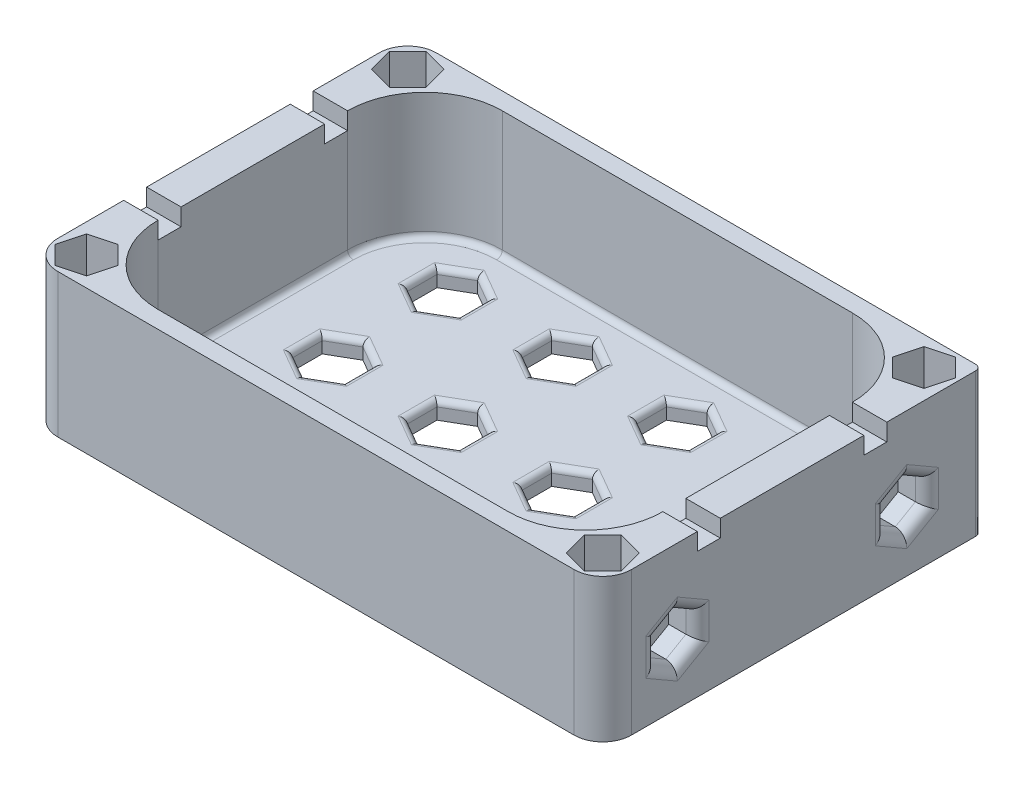
from build123d import *

# Parameters (mm, degrees)
BOSS_EXTRUDE7_DEPTH = 25
BOSS_EXTRUDE9_DEPTH = 3
CUT_EXTRUDE1_DEPTH  = 5
CUT_EXTRUDE2_DEPTH  = 5
FILLET3_R           = 2
FILLET2_R           = 1
FILLET4_R           = 1
SKETCH7_W           = 6
SKETCH7_H           = 4
CUT_EXTRUDE3_DEPTH  = 3


with BuildPart() as part:
    # Sketch3 → Boss-Extrude7 (new body)
    with BuildSketch(Plane.XZ):
        with BuildLine():
            Line((-5, -33), (0, -33))
            Line((0, -33), (-1.464466094, -31.535533906))
            ThreePointArc((-1.464466094, -31.535533906), (-3.086582838, -32.619397663), (-5, -33))
        make_face()
        with BuildLine():
            Line((0, -33), (0, -28))
            ThreePointArc((0, -28), (-0.380602337, -29.913417162), (-1.464466094, -31.535533906))
            Line((-1.464466094, -31.535533906), (0, -33))
        make_face()
        with BuildLine():
            ThreePointArc((0, -28), (-1.464466094, -24.464466094), (-5, -23))
            ThreePointArc((-5, -23), (-6.913417162, -23.380602337), (-8.535533906, -24.464466094))
            Line((-8.535533906, -24.464466094), (-7.740038777, -25.259961223))
            Line((-7.740038779, -25.259961224), (-6.158076652, -23.677999097))
            Line((-6.158076652, -23.677999097), (-3.997076244, -24.257037411))
            Line((-3.997076244, -24.257037411), (-1.836075749, -24.836075749))
            Line((-1.836075749, -24.836075749), (-1.257037428, -26.99707618))
            Line((-1.257037428, -26.99707618), (-0.677999097, -29.158076652))
            Line((-0.677999097, -29.158076652), (-2.259961219, -30.740038773))
            Line((-2.259961223, -30.740038777), (-1.464466094, -31.535533906))
            ThreePointArc((-1.464466094, -31.535533906), (-0.380602337, -29.913417162), (0, -28))
        make_face()
        with BuildLine():
            Line((-7.740038777, -25.259961223), (-8.535533906, -24.464466094))
            ThreePointArc((-8.535533906, -24.464466094), (-8.732910174, -24.67353316), (-8.917942987, -24.893599712))
            ThreePointArc((-8.917942987, -24.893599712), (-9.721743054, -26.355268249), (-10, -28))
            ThreePointArc((-10, -28), (-8.535533906, -31.535533906), (-5, -33))
            ThreePointArc((-5, -33), (-3.086582838, -32.619397663), (-1.464466094, -31.535533906))
            Line((-1.464466094, -31.535533906), (-2.259961223, -30.740038777))
            Line((-2.259961219, -30.740038773), (-3.841923348, -32.322000903))
            Line((-3.841923348, -32.322000903), (-6.002923801, -31.742962577))
            Line((-6.002923801, -31.742962577), (-8.163924251, -31.163924251))
            Line((-8.163924251, -31.163924251), (-8.742962601, -29.002923708))
            Line((-8.742962601, -29.002923708), (-9.322000903, -26.841923348))
            Line((-9.322000903, -26.841923348), (-7.740038779, -25.259961224))
        make_face()
        with BuildLine():
            Line((0, -28), (0, -23))
            Line((0, -23), (-5, -23))
            ThreePointArc((-5, -23), (-1.464466094, -24.464466094), (0, -28))
        make_face()
        with BuildLine():
            Line((-5, -23), (-6, -23))
            Line((-6, -23), (-7.661030441, -23))
            ThreePointArc((-7.661030441, -23), (-8.091942003, -23.730311477), (-8.567907791, -24.432092209))
            Line((-8.567907791, -24.432092209), (-8.535533906, -24.464466094))
            ThreePointArc((-8.535533906, -24.464466094), (-6.913417162, -23.380602337), (-5, -23))
        make_face()
        with BuildLine():
            ThreePointArc((-8.917942987, -24.893599712), (-9.440797856, -25.51377538), (-10, -26.101387527))
            Line((-10, -26.101387527), (-10, -28))
            ThreePointArc((-10, -28), (-9.721743054, -26.355268249), (-8.917942987, -24.893599712))
        make_face()
        with BuildLine():
            Line((-8.535533906, -24.464466094), (-8.567907791, -24.432092209))
            ThreePointArc((-8.567907791, -24.432092209), (-8.740446841, -24.664725841), (-8.917942987, -24.893599712))
            ThreePointArc((-8.917942987, -24.893599712), (-8.732910174, -24.67353316), (-8.535533906, -24.464466094))
        make_face()
        with BuildLine():
            ThreePointArc((-5, -33), (-8.535533906, -31.535533906), (-10, -28))
            Line((-10, -28), (-10, -30))
            Line((-10, -30), (-10, -33))
            Line((-10, -33), (-5, -33))
        make_face()
        with BuildLine():
            Line((-10, -28), (-10, -26.101387527))
            ThreePointArc((-10, -26.101387527), (-14.356609245, -28.987317436), (-19.483314774, -30))
            Line((-19.483314774, -30), (-10, -30))
            Line((-10, -30), (-10, -28))
        make_face()
        Polygon((-10, -30), (-19.483314774, -30), (-80.516685226, -30), (-90, -30), (-90, -33), (-10, -33), align=None)
        Polygon((0, 0), (-6, 0), (-6, -16.516685226), (-6, -23), (-5, -23), (0, -23), align=None)
        with BuildLine():
            Line((-6, -23), (-6, -16.516685226))
            ThreePointArc((-6, -16.516685226), (-6.421857001, -19.863041177), (-7.661030441, -23))
            Line((-7.661030441, -23), (-6, -23))
        make_face()
        Polygon((-6, 16.516685226), (-6, 0), (0, 0), (0, 23), (-5, 23), (-6, 23), align=None)
        with BuildLine():
            ThreePointArc((-7.661030441, 23), (-6.421857001, 19.863041177), (-6, 16.516685226))
            Line((-6, 16.516685226), (-6, 23))
            Line((-6, 23), (-7.661030441, 23))
        make_face()
        with BuildLine():
            Line((-7.661030441, 23), (-6, 23))
            Line((-6, 23), (-5, 23))
            ThreePointArc((-5, 23), (-6.913417162, 23.380602337), (-8.535533906, 24.464466094))
            Line((-8.535533906, 24.464466094), (-8.567907791, 24.432092209))
            ThreePointArc((-8.567907791, 24.432092209), (-8.091942003, 23.730311477), (-7.661030441, 23))
        make_face()
        with BuildLine():
            Line((-10, 28), (-10, 26.101387527))
            ThreePointArc((-10, 26.101387527), (-9.440797857, 25.513775382), (-8.91794299, 24.893599716))
            ThreePointArc((-8.91794299, 24.893599716), (-9.721743055, 26.355268251), (-10, 28))
        make_face()
        with BuildLine():
            ThreePointArc((-19.483314774, 30), (-14.356609245, 28.987317436), (-10, 26.101387527))
            Line((-10, 26.101387527), (-10, 28))
            Line((-10, 28), (-10, 30))
            Line((-10, 30), (-19.483314774, 30))
        make_face()
        with BuildLine():
            ThreePointArc((-8.91794299, 24.893599716), (-8.740446842, 24.664725843), (-8.567907791, 24.432092209))
            Line((-8.567907791, 24.432092209), (-8.535533906, 24.464466094))
            ThreePointArc((-8.535533906, 24.464466094), (-8.732910175, 24.673533162), (-8.91794299, 24.893599716))
        make_face()
        with BuildLine():
            ThreePointArc((-8.91794299, 24.893599716), (-8.732910175, 24.673533162), (-8.535533906, 24.464466094))
            Line((-8.535533906, 24.464466094), (-7.740038777, 25.259961223))
            Line((-7.740038777, 25.259961223), (-9.322000903, 26.841923348))
            Line((-9.322000903, 26.841923348), (-8.742962597, 29.002923724))
            Line((-8.742962597, 29.002923724), (-8.163924251, 31.163924251))
            Line((-8.163924251, 31.163924251), (-6.002923796, 31.742962578))
            Line((-6.002923796, 31.742962578), (-3.841923348, 32.322000903))
            Line((-3.841923348, 32.322000903), (-2.259961222, 30.740038776))
            Line((-2.259961223, 30.740038777), (-1.464466094, 31.535533906))
            ThreePointArc((-1.464466094, 31.535533906), (-3.086582838, 32.619397663), (-5, 33))
            ThreePointArc((-5, 33), (-8.535533906, 31.535533906), (-10, 28))
            ThreePointArc((-10, 28), (-9.721743055, 26.355268251), (-8.91794299, 24.893599716))
        make_face()
        with BuildLine():
            ThreePointArc((-8.535533906, 24.464466094), (-6.913417162, 23.380602337), (-5, 23))
            ThreePointArc((-5, 23), (-1.464466094, 24.464466094), (0, 28))
            ThreePointArc((0, 28), (-0.380602337, 29.913417162), (-1.464466094, 31.535533906))
            Line((-1.464466094, 31.535533906), (-2.259961223, 30.740038777))
            Line((-2.259961222, 30.740038776), (-0.677999097, 29.158076652))
            Line((-0.677999097, 29.158076652), (-1.257037425, 26.997076192))
            Line((-1.257037425, 26.997076192), (-1.836075749, 24.836075749))
            Line((-1.836075749, 24.836075749), (-3.997076664, 24.257037299))
            Line((-3.997076664, 24.257037299), (-6.158076652, 23.677999097))
            Line((-6.158076652, 23.677999097), (-7.740038777, 25.259961223))
            Line((-7.740038777, 25.259961223), (-8.535533906, 24.464466094))
        make_face()
        with BuildLine():
            Line((-5, 23), (0, 23))
            Line((0, 23), (0, 28))
            ThreePointArc((0, 28), (-1.464466094, 24.464466094), (-5, 23))
        make_face()
        Polygon((-80.516685226, 30), (-19.483314774, 30), (-10, 30), (-10, 33), (-90, 33), (-90, 30), align=None)
        with BuildLine():
            Line((-10, 30), (-10, 28))
            ThreePointArc((-10, 28), (-8.535533906, 31.535533906), (-5, 33))
            Line((-5, 33), (-10, 33))
            Line((-10, 33), (-10, 30))
        make_face()
        with BuildLine():
            Line((-90, -30), (-80.516685226, -30))
            ThreePointArc((-80.516685226, -30), (-85.643390755, -28.987317436), (-90, -26.101387527))
            Line((-90, -26.101387527), (-90, -28))
            Line((-90, -28), (-90, -30))
        make_face()
        with BuildLine():
            Line((-90, -33), (-90, -30))
            Line((-90, -30), (-90, -28))
            ThreePointArc((-90, -28), (-91.464466094, -31.535533906), (-95, -33))
            Line((-95, -33), (-90, -33))
        make_face()
        with BuildLine():
            ThreePointArc((-95, -33), (-91.464466094, -31.535533906), (-90, -28))
            ThreePointArc((-90, -28), (-90.278256873, -26.355268458), (-91.082056738, -24.893600059))
            ThreePointArc((-91.082056738, -24.893600059), (-91.267089679, -24.673533326), (-91.464466094, -24.464466094))
            Line((-91.464466094, -24.464466094), (-92.259961223, -25.259961223))
            Line((-92.259961223, -25.259961223), (-90.677999097, -26.841923348))
            Line((-90.677999097, -26.841923348), (-91.257037439, -29.00292386))
            Line((-91.257037439, -29.00292386), (-91.836075749, -31.163924251))
            Line((-91.836075749, -31.163924251), (-93.997076192, -31.742962575))
            Line((-93.997076192, -31.742962575), (-96.158076652, -32.322000903))
            Line((-96.158076652, -32.322000903), (-97.740038777, -30.740038777))
            Line((-97.740038777, -30.740038777), (-98.535533906, -31.535533906))
            ThreePointArc((-98.535533906, -31.535533906), (-96.913417162, -32.619397663), (-95, -33))
        make_face()
        with BuildLine():
            Line((-92.259961223, -25.259961223), (-91.464466094, -24.464466094))
            ThreePointArc((-91.464466094, -24.464466094), (-93.086582815, -23.380602347), (-94.999999951, -23))
            ThreePointArc((-94.999999951, -23), (-98.535533888, -24.464466077), (-100, -28))
            ThreePointArc((-100, -28), (-99.619397663, -29.913417162), (-98.535533906, -31.535533906))
            Line((-98.535533906, -31.535533906), (-97.740038777, -30.740038777))
            Line((-97.740038777, -30.740038777), (-99.322000903, -29.158076652))
            Line((-99.322000903, -29.158076652), (-98.742962693, -26.997076632))
            Line((-98.742962693, -26.997076632), (-98.163924251, -24.836075749))
            Line((-98.163924251, -24.836075749), (-96.002923368, -24.257037307))
            Line((-96.002923368, -24.257037307), (-93.841923348, -23.677999097))
            Line((-93.841923348, -23.677999097), (-92.259961223, -25.259961223))
        make_face()
        with BuildLine():
            ThreePointArc((-100, -28), (-98.535533888, -24.464466077), (-94.999999951, -23))
            Line((-94.999999951, -23), (-100, -23))
            Line((-100, -23), (-100, -28))
        make_face()
        with BuildLine():
            ThreePointArc((-91.464466094, -24.464466094), (-91.267089679, -24.673533326), (-91.082056738, -24.893600059))
            ThreePointArc((-91.082056738, -24.893600059), (-91.259553025, -24.664726018), (-91.432092209, -24.432092209))
            Line((-91.432092209, -24.432092209), (-91.464466094, -24.464466094))
        make_face()
        with BuildLine():
            ThreePointArc((-91.432092209, -24.432092209), (-91.908057997, -23.730311477), (-92.338969559, -23))
            Line((-92.338969559, -23), (-94, -23))
            Line((-94, -23), (-94.999999951, -23))
            ThreePointArc((-94.999999951, -23), (-93.086582815, -23.380602347), (-91.464466094, -24.464466094))
            Line((-91.464466094, -24.464466094), (-91.432092209, -24.432092209))
        make_face()
        with BuildLine():
            Line((-90, -28), (-90, -26.101387527))
            ThreePointArc((-90, -26.101387527), (-90.559201997, -25.513775545), (-91.082056738, -24.893600059))
            ThreePointArc((-91.082056738, -24.893600059), (-90.278256873, -26.355268458), (-90, -28))
        make_face()
        Polygon((-94, 16.516685226), (-94, 23), (-95, 23), (-100, 23), (-100, -23), (-94.999999951, -23), (-94, -23), (-94, -16.516685226), align=None)
        with BuildLine():
            Line((-94, -23), (-92.338969559, -23))
            ThreePointArc((-92.338969559, -23), (-93.578142999, -19.863041177), (-94, -16.516685226))
            Line((-94, -16.516685226), (-94, -23))
        make_face()
        with BuildLine():
            ThreePointArc((-94, 16.516685226), (-93.578142999, 19.863041177), (-92.338969559, 23))
            Line((-92.338969559, 23), (-94, 23))
            Line((-94, 23), (-94, 16.516685226))
        make_face()
        with BuildLine():
            Line((-94, 23), (-92.338969559, 23))
            ThreePointArc((-92.338969559, 23), (-91.908057997, 23.730311477), (-91.432092209, 24.432092209))
            Line((-91.432092209, 24.432092209), (-91.464466094, 24.464466094))
            ThreePointArc((-91.464466094, 24.464466094), (-93.086582838, 23.380602337), (-95, 23))
            Line((-95, 23), (-94, 23))
        make_face()
        with BuildLine():
            ThreePointArc((-91.432092209, 24.432092209), (-91.259553334, 24.66472561), (-91.082057373, 24.893599258))
            ThreePointArc((-91.082057373, 24.893599258), (-91.267090019, 24.673532944), (-91.464466094, 24.464466094))
            Line((-91.464466094, 24.464466094), (-91.432092209, 24.432092209))
        make_face()
        with BuildLine():
            ThreePointArc((-91.082057373, 24.893599258), (-90.559202338, 25.513775164), (-90, 26.101387527))
            Line((-90, 26.101387527), (-90, 28))
            ThreePointArc((-90, 28), (-90.278257041, 26.355267975), (-91.082057373, 24.893599258))
        make_face()
        with BuildLine():
            ThreePointArc((-91.082057373, 24.893599258), (-90.278257041, 26.355267975), (-90, 28))
            ThreePointArc((-90, 28), (-91.464466094, 31.535533906), (-95, 33))
            ThreePointArc((-95, 33), (-96.913417162, 32.619397663), (-98.535533906, 31.535533906))
            Line((-98.535533906, 31.535533906), (-97.740038777, 30.740038777))
            Line((-97.740038777, 30.740038777), (-96.158076652, 32.322000903))
            Line((-96.158076652, 32.322000903), (-93.997076276, 31.742962597))
            Line((-93.997076276, 31.742962597), (-91.836075749, 31.163924251))
            Line((-91.836075749, 31.163924251), (-91.257037406, 29.002923736))
            Line((-91.257037406, 29.002923736), (-90.677999097, 26.841923348))
            Line((-90.677999097, 26.841923348), (-92.259961223, 25.259961223))
            Line((-92.259961223, 25.259961223), (-91.464466094, 24.464466094))
            ThreePointArc((-91.464466094, 24.464466094), (-91.267090019, 24.673532944), (-91.082057373, 24.893599258))
        make_face()
        with BuildLine():
            ThreePointArc((-95, 23), (-93.086582838, 23.380602337), (-91.464466094, 24.464466094))
            Line((-91.464466094, 24.464466094), (-92.259961223, 25.259961223))
            Line((-92.259961223, 25.259961223), (-93.841923348, 23.677999097))
            Line((-93.841923348, 23.677999097), (-96.00292408, 24.257037498))
            Line((-96.00292408, 24.257037498), (-98.163924251, 24.836075749))
            Line((-98.163924251, 24.836075749), (-98.742962597, 26.997076276))
            Line((-98.742962597, 26.997076276), (-99.322000903, 29.158076652))
            Line((-99.322000903, 29.158076652), (-97.740038777, 30.740038777))
            Line((-97.740038777, 30.740038777), (-98.535533906, 31.535533906))
            ThreePointArc((-98.535533906, 31.535533906), (-99.619397687, 29.913417102), (-100, 27.999999871))
            ThreePointArc((-100, 27.999999871), (-98.53553386, 24.464466048), (-95, 23))
        make_face()
        with BuildLine():
            Line((-100, 23), (-95, 23))
            ThreePointArc((-95, 23), (-98.53553386, 24.464466048), (-100, 27.999999871))
            Line((-100, 27.999999871), (-100, 23))
        make_face()
        with BuildLine():
            Line((-90, 28), (-90, 30))
            Line((-90, 30), (-90, 33))
            Line((-90, 33), (-95, 33))
            ThreePointArc((-95, 33), (-91.464466094, 31.535533906), (-90, 28))
        make_face()
        with BuildLine():
            ThreePointArc((-90, 26.101387527), (-85.643390755, 28.987317436), (-80.516685226, 30))
            Line((-80.516685226, 30), (-90, 30))
            Line((-90, 30), (-90, 28))
            Line((-90, 28), (-90, 26.101387527))
        make_face()
    extrude(amount=-BOSS_EXTRUDE7_DEPTH)

    # Sketch3<7> → Boss-Extrude9 (add)
    with BuildSketch(Plane.XZ):
        with BuildLine():
            Line((-6, -16.516685226), (-6, 0))
            Line((-6, 0), (-6, 16.516685226))
            ThreePointArc((-6, 16.516685226), (-9.949171464, 26.050828536), (-19.483314774, 30))
            Line((-19.483314774, 30), (-80.516685226, 30))
            ThreePointArc((-80.516685226, 30), (-90.050828536, 26.050828536), (-94, 16.516685226))
            Line((-94, 16.516685226), (-94, -16.516685226))
            ThreePointArc((-94, -16.516685226), (-90.050828536, -26.050828536), (-80.516685226, -30))
            Line((-80.516685226, -30), (-19.483314774, -30))
            ThreePointArc((-19.483314774, -30), (-9.949171464, -26.050828536), (-6, -16.516685226))
        make_face()
        Polygon((-84.5, -17.401923789), (-80, -14.803847577), (-75.5, -17.401923789), (-75.5, -22.598076211), (-80, -25.196152423), (-84.5, -22.598076211), align=None, mode=Mode.SUBTRACT)
        Polygon((-64.5, -17.401923789), (-60, -14.803847577), (-55.5, -17.401923789), (-55.5, -22.598076211), (-60, -25.196152423), (-64.5, -22.598076211), align=None, mode=Mode.SUBTRACT)
        Polygon((-75.5, 2.598076211), (-75.5, -2.598076211), (-80, -5.196152423), (-84.5, -2.598076211), (-84.5, 2.598076211), (-80, 5.196152423), align=None, mode=Mode.SUBTRACT)
        Polygon((-44.5, -17.401923789), (-40, -14.803847577), (-35.5, -17.401923789), (-35.5, -22.598076211), (-40, -25.196152423), (-44.5, -22.598076211), align=None, mode=Mode.SUBTRACT)
        Polygon((-24.5, -22.598076211), (-24.5, -17.401923789), (-20, -14.803847577), (-15.5, -17.401923789), (-15.5, -22.598076211), (-20, -25.196152423), align=None, mode=Mode.SUBTRACT)
        Polygon((-55.5, 2.598076211), (-55.5, -2.598076211), (-60, -5.196152423), (-64.5, -2.598076211), (-64.5, 2.598076211), (-60, 5.196152423), align=None, mode=Mode.SUBTRACT)
        Polygon((-75.5, 17.401923789), (-80, 14.803847577), (-84.5, 17.401923789), (-84.5, 22.598076211), (-80, 25.196152423), (-75.5, 22.598076211), align=None, mode=Mode.SUBTRACT)
        Polygon((-60, 14.803847577), (-64.5, 17.401923789), (-64.5, 22.598076211), (-60, 25.196152423), (-55.5, 22.598076211), (-55.5, 17.401923789), align=None, mode=Mode.SUBTRACT)
        Polygon((-35.5, 2.598076211), (-35.5, -2.598076211), (-40, -5.196152423), (-44.5, -2.598076211), (-44.5, 2.598076211), (-40, 5.196152423), align=None, mode=Mode.SUBTRACT)
        Polygon((-15.5, 2.598076211), (-15.5, 0), (-15.5, -2.598076211), (-20, -5.196152423), (-24.5, -2.598076211), (-24.5, 2.598076211), (-20, 5.196152423), align=None, mode=Mode.SUBTRACT)
        Polygon((-35.5, 22.598076211), (-35.5, 17.401923789), (-40, 14.803847577), (-44.5, 17.401923789), (-44.5, 22.598076211), (-40, 25.196152423), align=None, mode=Mode.SUBTRACT)
        Polygon((-15.5, 17.401923789), (-20, 14.803847577), (-24.5, 17.401923789), (-24.5, 22.598076211), (-20, 25.196152423), (-15.5, 22.598076211), align=None, mode=Mode.SUBTRACT)
    extrude(amount=-BOSS_EXTRUDE9_DEPTH)

    # Sketch5 → Cut-Extrude1 (cut)
    with BuildSketch(Plane.ZY.offset(100)):
        Polygon((-20, 6.458548116), (-16.5, 8.479274058), (-16.5, 12.520725942), (-20, 14.541451884), (-23.5, 12.520725942), (-23.5, 8.479274058), align=None)
        Polygon((23.5, 8.479274058), (23.5, 12.520725942), (20, 14.541451884), (16.5, 12.520725942), (16.5, 8.479274058), (20, 6.458548116), align=None)
    extrude(amount=-CUT_EXTRUDE1_DEPTH, mode=Mode.SUBTRACT)

    # Sketch6 → Cut-Extrude2 (cut)
    with BuildSketch(Plane(origin=(0, 0, 0), x_dir=(0, 0, -1), z_dir=(1, 0, 0))):
        Polygon((-20, 6.458548116), (-16.5, 8.479274058), (-16.5, 12.520725942), (-20, 14.541451884), (-23.5, 12.520725942), (-23.5, 8.479274058), align=None)
        Polygon((20, 6.458548116), (23.5, 8.479274058), (23.5, 12.520725942), (20, 14.541451884), (16.5, 12.520725942), (16.5, 8.479274058), align=None)
    extrude(amount=-CUT_EXTRUDE2_DEPTH, mode=Mode.SUBTRACT)

    # Fillet3
    fillet3_edges = [part.edges().sort_by_distance(p)[0] for p in [
        (-100, 7.468911087, -21.75),
        (-100, 7.468911087, -18.25),
        (-100, 10.5, -16.5),
        (-100, 13.531088913, -18.25),
        (-100, 13.531088913, -21.75),
        (-100, 10.5, -23.5),
        (-100, 7.468911087, 18.25),
        (-100, 7.468911087, 21.75),
        (-100, 10.5, 23.5),
        (-100, 13.531088913, 21.75),
        (-100, 13.531088913, 18.25),
        (-100, 10.5, 16.5),
        (0, 13.531088913, 18.25),
        (0, 13.531088913, 21.75),
        (0, 10.5, 23.5),
        (0, 7.468911087, 21.75),
        (0, 7.468911087, 18.25),
        (0, 10.5, 16.5),
        (0, 13.531088913, -21.75),
        (0, 13.531088913, -18.25),
        (0, 10.5, -16.5),
        (0, 7.468911087, -18.25),
        (0, 7.468911087, -21.75),
        (0, 10.5, -23.5),
    ]]
    fillet(fillet3_edges, radius=FILLET3_R)

    # Fillet2
    fillet2_edges = [part.edges().sort_by_distance(p)[0] for p in [
        (0, 12.5, -33),
    ]]
    fillet(fillet2_edges, radius=FILLET2_R)

    # Fillet4
    fillet4_edges = [part.edges().sort_by_distance(p)[0] for p in [
        (-50, 3, -30),
        (-90.050828536, 3, -26.050828536),
        (-94, 3, 0),
        (-37.75, 3, 3.897114317),
        (-42.25, 3, 3.897114317),
        (-44.5, 3, 0),
        (-42.25, 3, -3.897114317),
        (-37.75, 3, -3.897114317),
        (-35.5, 3, 0),
        (-62.25, 3, 16.102885683),
        (-57.75, 3, 16.102885683),
        (-55.5, 3, 20),
        (-57.75, 3, 23.897114317),
        (-62.25, 3, 23.897114317),
        (-64.5, 3, 20),
        (-75.5, 3, 0),
        (-77.75, 3, 3.897114317),
        (-82.25, 3, 3.897114317),
        (-84.5, 3, 0),
        (-82.25, 3, -3.897114317),
        (-77.75, 3, -3.897114317),
        (-62.25, 3, -3.897114317),
        (-57.75, 3, -3.897114317),
        (-55.5, 3, 0),
        (-57.75, 3, 3.897114317),
        (-62.25, 3, 3.897114317),
        (-64.5, 3, 0),
        (-42.25, 3, 16.102885683),
        (-37.75, 3, 16.102885683),
        (-35.5, 3, 20),
        (-37.75, 3, 23.897114317),
        (-42.25, 3, 23.897114317),
        (-44.5, 3, 20),
        (-37.75, 3, -16.102885683),
        (-42.25, 3, -16.102885683),
        (-44.5, 3, -20),
        (-42.25, 3, -23.897114317),
        (-37.75, 3, -23.897114317),
        (-35.5, 3, -20),
        (-22.25, 3, 3.897114317),
        (-24.5, 3, 0),
        (-22.25, 3, -3.897114317),
        (-17.75, 3, -3.897114317),
        (-15.5, 3, 0),
        (-17.75, 3, 3.897114317),
        (-90.050828536, 3, 26.050828536),
        (-50, 3, 30),
        (-9.949171464, 3, 26.050828536),
        (-6, 3, 0),
        (-9.949171464, 3, -26.050828536),
        (-22.25, 3, 16.102885683),
        (-17.75, 3, 16.102885683),
        (-15.5, 3, 20),
        (-17.75, 3, 23.897114317),
        (-22.25, 3, 23.897114317),
        (-24.5, 3, 20),
        (-77.75, 3, 16.102885683),
        (-75.5, 3, 20),
        (-77.75, 3, 23.897114317),
        (-82.25, 3, 23.897114317),
        (-84.5, 3, 20),
        (-82.25, 3, 16.102885683),
        (-77.75, 3, -16.102885683),
        (-82.25, 3, -16.102885683),
        (-84.5, 3, -20),
        (-82.25, 3, -23.897114317),
        (-77.75, 3, -23.897114317),
        (-75.5, 3, -20),
        (-22.25, 3, -16.102885683),
        (-24.5, 3, -20),
        (-22.25, 3, -23.897114317),
        (-17.75, 3, -23.897114317),
        (-15.5, 3, -20),
        (-17.75, 3, -16.102885683),
        (-57.75, 3, -16.102885683),
        (-62.25, 3, -16.102885683),
        (-64.5, 3, -20),
        (-62.25, 3, -23.897114317),
        (-57.75, 3, -23.897114317),
        (-55.5, 3, -20),
    ]]
    fillet(fillet4_edges, radius=FILLET4_R)

    # Sketch7 → Cut-Extrude3 (cut)
    with BuildSketch(Plane(origin=(0, 25, 0), x_dir=(1, 0, 0), z_dir=(0, 1, 0))):
        with Locations((-97, 14.516685226)):
            Rectangle(SKETCH7_W, SKETCH7_H)
        with Locations((-97, -14.516685226)):
            Rectangle(SKETCH7_W, SKETCH7_H)
        with Locations((-3, 14.516685226)):
            Rectangle(SKETCH7_W, SKETCH7_H)
        with Locations((-3, -14.516685226)):
            Rectangle(SKETCH7_W, SKETCH7_H)
    extrude(amount=-CUT_EXTRUDE3_DEPTH, mode=Mode.SUBTRACT)


solid = part.part
